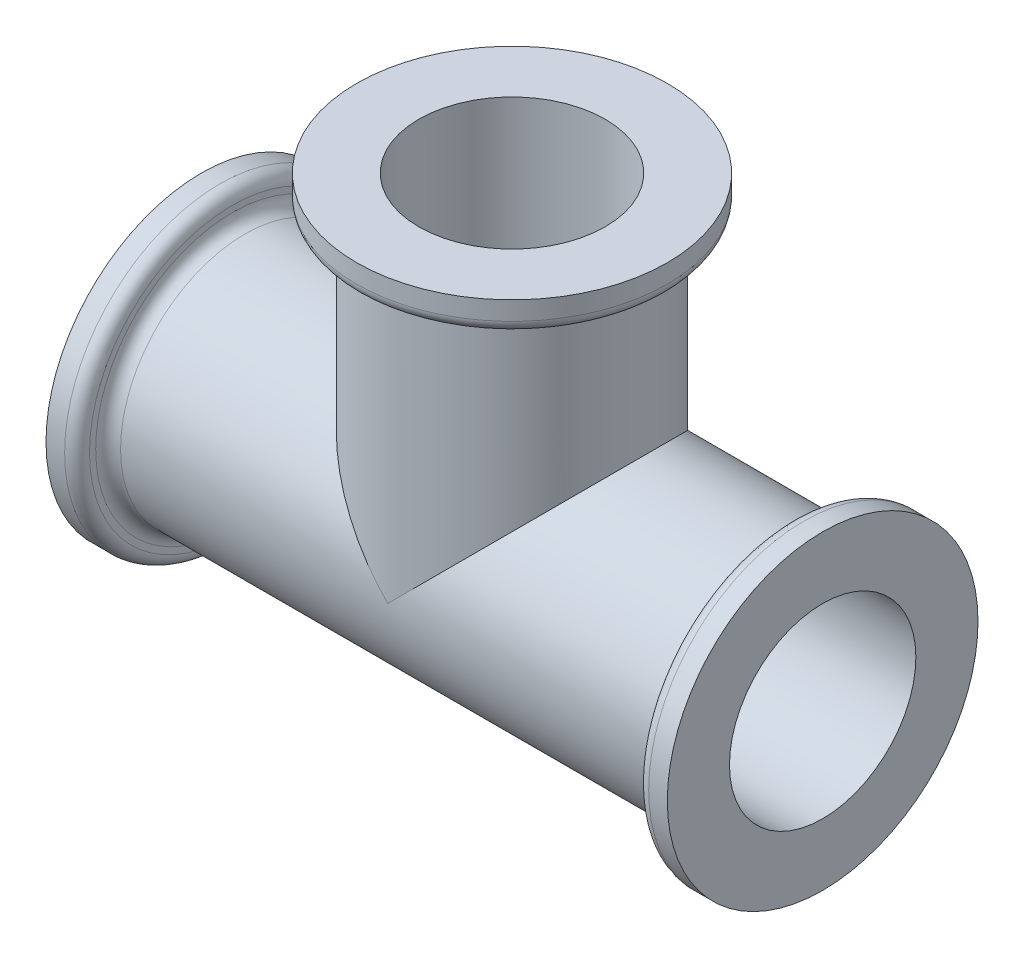
from build123d import *

# Parameters (mm, degrees)
BOSS_EXTRUDE1_REACH      = 48.771
BOSS_EXTRUDE1_END_RADIUS = 10
SKETCH2_R                = 10
SKETCH3_R                = 12.5
BOSS_EXTRUDE2_DEPTH      = 2.5
CUT_EXTRUDE1_REACH       = 48.771
CUT_EXTRUDE1_END_RADIUS  = 7.5
SKETCH6_R                = 7.5
FILLET1_R                = 1
FILLET2_R                = 1


with BuildPart() as part:
    # Sketch1 → Revolve1 (revolve)
    with BuildSketch(Plane.XY, mode=Mode.PRIVATE) as revolve1_sk:
        Polygon((-25, 7.5), (-25, 12.5), (-22.5, 12.5), (-22.5, 10), (22.5, 10), (22.5, 12.5), (25, 12.5), (25, 7.5), align=None)
    revolve(revolve1_sk.sketch.rotate(Axis((0, 0, 0), (1, 0, 0)), 90), axis=Axis((0, 0, 0), (1, 0, 0)))

    # Boss-Extrude1: up to this cylinder (the profile starts outside it)
    boss_extrude1_end = Plane(origin=(0, 0, 0), z_dir=(-1, 0, 0)) * Cylinder(BOSS_EXTRUDE1_END_RADIUS, 118.542, mode=Mode.PRIVATE)
    # Sketch2 → Boss-Extrude1 (add, up to the surface)
    with BuildSketch(Plane(origin=(0, 25, 0), x_dir=(1, 0, 0), z_dir=(0, 1, 0)), mode=Mode.PRIVATE) as boss_extrude1_sk1:
        with Locations(Location((0, 0, 0), (0, 0, 270))):
            Circle(SKETCH2_R)
    boss_extrude1_tool1 = extrude(boss_extrude1_sk1.sketch, amount=-BOSS_EXTRUDE1_REACH, mode=Mode.PRIVATE) - boss_extrude1_end
    add(boss_extrude1_tool1.solids().sort_by_distance((0, 25, 0))[0])

    # Sketch3 → Boss-Extrude2 (add)
    with BuildSketch(Plane(origin=(0, 25, 0), x_dir=(1, 0, 0), z_dir=(0, 1, 0))):
        with Locations(Location((0, 0, 0), (0, 0, 270))):
            Circle(SKETCH3_R)
    extrude(amount=-BOSS_EXTRUDE2_DEPTH)

    # Cut-Extrude1: up to this cylinder (the profile starts outside it)
    cut_extrude1_end = Plane(origin=(0, 0, 0), z_dir=(-1, 0, 0)) * Cylinder(CUT_EXTRUDE1_END_RADIUS, 113.542, mode=Mode.PRIVATE)
    # Sketch6 → Cut-Extrude1 (cut, up to the surface)
    with BuildSketch(Plane(origin=(0, 25, 0), x_dir=(1, 0, 0), z_dir=(0, 1, 0)), mode=Mode.PRIVATE) as cut_extrude1_sk1:
        with Locations(Location((0, 0, 0), (0, 0, 270))):
            Circle(SKETCH6_R)
    cut_extrude1_tool1 = extrude(cut_extrude1_sk1.sketch, amount=-CUT_EXTRUDE1_REACH, mode=Mode.PRIVATE) - cut_extrude1_end
    add(cut_extrude1_tool1.solids().sort_by_distance((0, 25, 0))[0], mode=Mode.SUBTRACT)

    # Fillet1
    fillet1_edges = [part.edges().sort_by_distance(p)[0] for p in [
        (0, 22.5, -10),
        (22.5, 0, -10),
        (-22.5, 0, -10),
    ]]
    fillet(fillet1_edges, radius=FILLET1_R)

    # Fillet2
    fillet2_edges = [part.edges().sort_by_distance(p)[0] for p in [
        (0, 22.5, -12.5),
        (22.5, 0, -12.5),
        (-22.5, 0, -12.5),
    ]]
    fillet(fillet2_edges, radius=FILLET2_R)


solid = part.part
